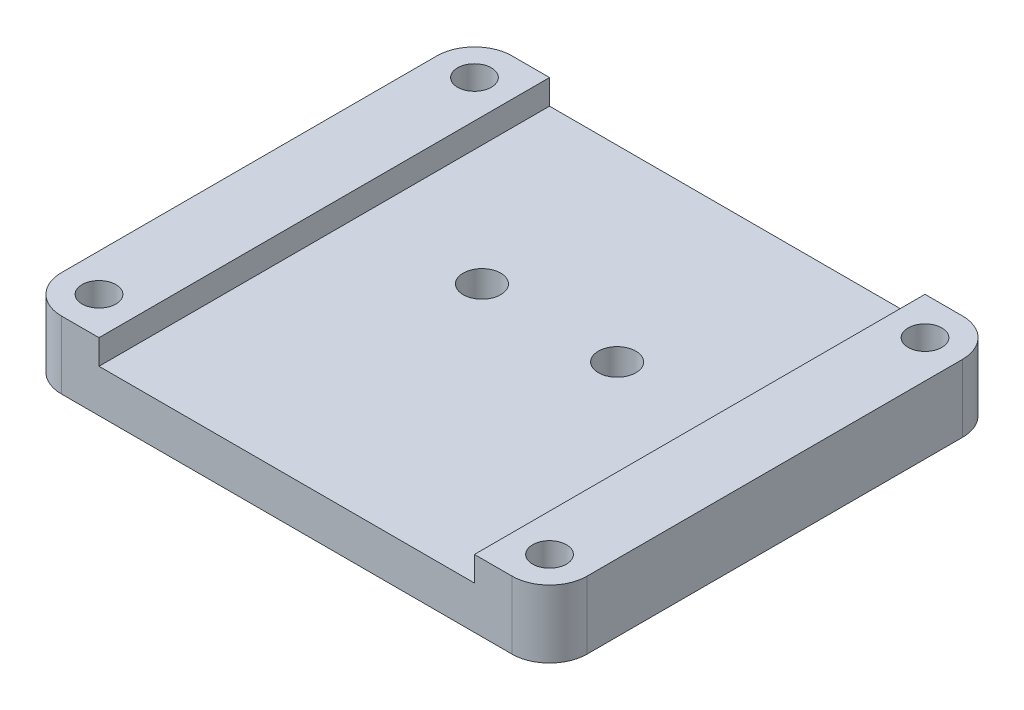
from build123d import *

# Parameters (mm, degrees)
SKETCH1_W           = 70
SKETCH1_H           = 60
BOSS_EXTRUDE1_DEPTH = 5.7
SKETCH2_W           = 10
SKETCH2_H           = 60
SKETCH2_R           = 2.25
BOSS_EXTRUDE2_DEPTH = 3.3
FILLET1_R           = 5
SKETCH2_4_R         = 2.5
CUT_EXTRUDE2_DEPTH  = 5


with BuildPart() as part:
    # Sketch1 → Boss-Extrude1 (new body)
    with BuildSketch(Plane(origin=(0, 0, 0), x_dir=(1, 0, 0), z_dir=(0, 1, 0))):
        Rectangle(SKETCH1_W, SKETCH1_H)
    extrude(amount=BOSS_EXTRUDE1_DEPTH)

    # Sketch2 → Boss-Extrude2 (add)
    # profile 1 of 2: a face of its own
    with BuildSketch(Plane(origin=(0, 5.7, 0), x_dir=(1, 0, 0), z_dir=(0, 1, 0))):
        with Locations((-30, 0)):
            Rectangle(SKETCH2_W, SKETCH2_H)
        with Locations((-30, -25)):
            Circle(SKETCH2_R, mode=Mode.SUBTRACT)
        with Locations((-30, 25)):
            Circle(SKETCH2_R, mode=Mode.SUBTRACT)
    # profile 2 of 2: a face of its own
    with BuildSketch(Plane(origin=(0, 5.7, 0), x_dir=(1, 0, 0), z_dir=(0, 1, 0))):
        with Locations((30, 0)):
            Rectangle(SKETCH2_W, SKETCH2_H)
        with Locations((30, -25)):
            Circle(SKETCH2_R, mode=Mode.SUBTRACT)
        with Locations((30, 25)):
            Circle(SKETCH2_R, mode=Mode.SUBTRACT)
    extrude(amount=BOSS_EXTRUDE2_DEPTH)

    # Fillet1
    fillet1_edges = [part.edges().sort_by_distance(p)[0] for p in [
        (35, 4.5, 30),
        (35, 4.5, -30),
        (-35, 4.5, -30),
        (-35, 4.5, 30),
    ]]
    fillet(fillet1_edges, radius=FILLET1_R)

    # Sketch2<4> → Cut-Extrude2 (cut)
    with BuildSketch(Plane(origin=(0, 5.7, 0), x_dir=(1, 0, 0), z_dir=(0, 1, 0))):
        with Locations((-9, 5)):
            Circle(SKETCH2_4_R)
        with Locations((9, 5)):
            Circle(SKETCH2_4_R)
    extrude(amount=-CUT_EXTRUDE2_DEPTH, mode=Mode.SUBTRACT)


solid = part.part
